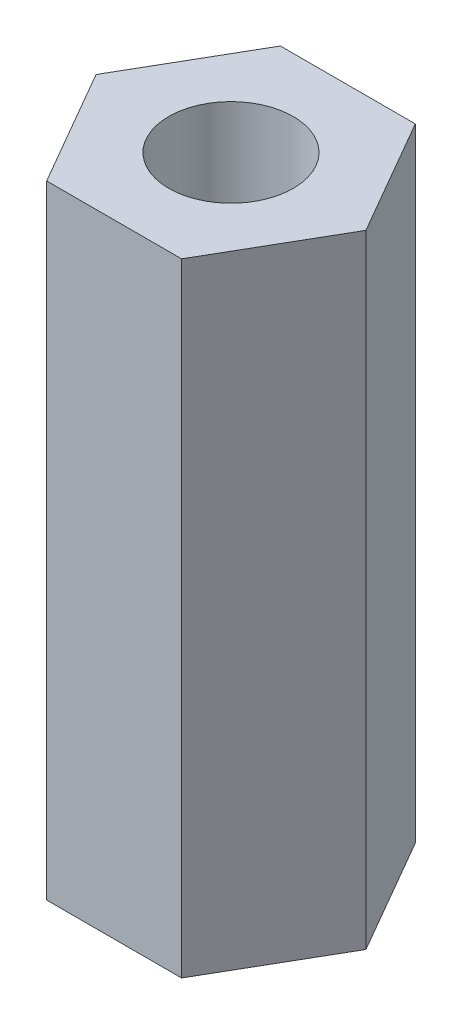
from build123d import *

# Parameters (mm, degrees)
SKETCH_2_R      = 1.5
EXTRUDE_1_DEPTH = 15


with BuildPart() as part:
    # 草图2 → 凸台-拉伸1 (new body)
    with BuildSketch(Plane(origin=(0, 0, 0), x_dir=(1, 0, 0), z_dir=(0, 1, 0))):
        Polygon((-1.625, 2.814582562), (-3.25, 0), (-1.625, -2.814582562), (1.625, -2.814582562), (3.25, 0), (1.625, 2.814582562), align=None)
        with Locations(Location((0, 0, 0), (0, 0, 270))):
            Circle(SKETCH_2_R, mode=Mode.SUBTRACT)
    extrude(amount=EXTRUDE_1_DEPTH)


solid = part.part
